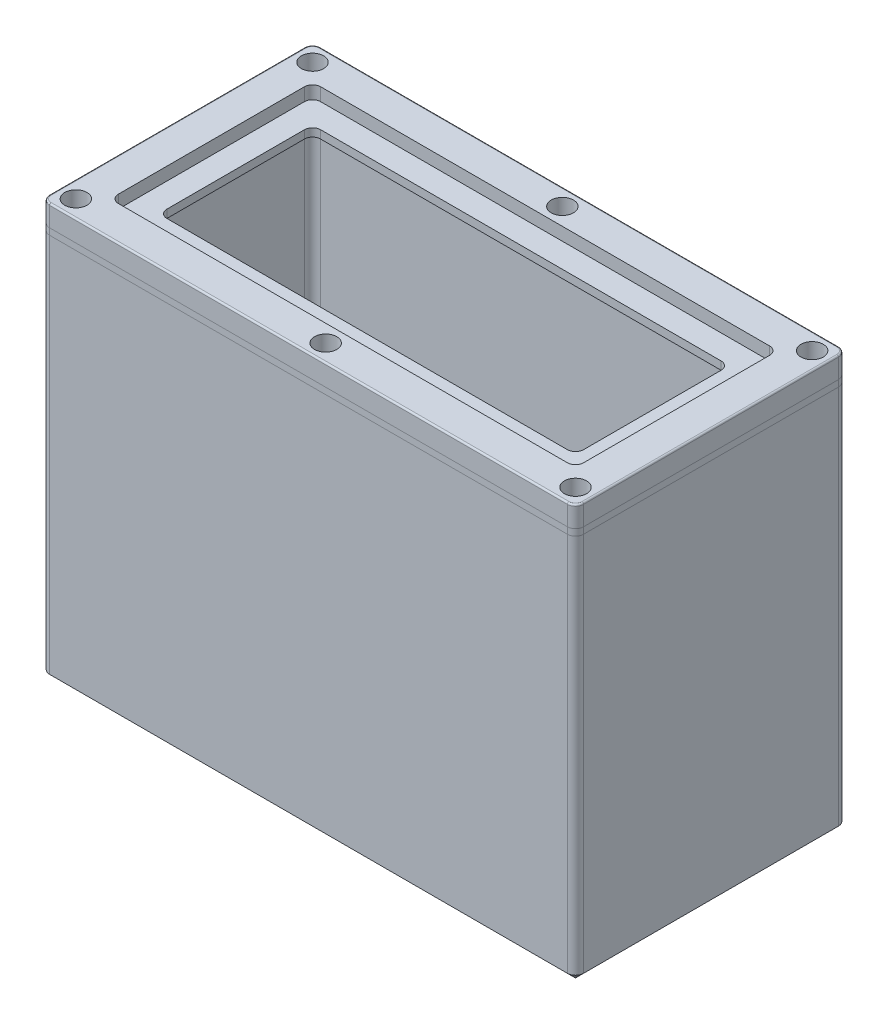
from build123d import *

# Parameters (mm, degrees)
BOX_OUTLINE_W            = 132
BOX_OUTLINE_H            = 67
BOSS_EXTRUDE2_DEPTH      = 4
BOX_OUTLINE_4_W          = 132
BOX_OUTLINE_4_H          = 67
BOX_OUTLINE_4_W_2        = 115
BOX_OUTLINE_4_H_2        = 50
BOSS_EXTRUDE3_DEPTH      = 92
MOTOR_OUTLINE_R          = 4.5
BOSS_EXTRUDE4_DEPTH      = 5
CUT_EXTRUDE1_DEPTH       = 119.077305186
CUT_EXTRUDE1_DEPTH_BACK  = 119.077305186
MOTOR_OUTLINE_3_R        = 4
M4_MOTOR_MOUNTS_D        = 4.5
SKETCH11_R               = 4.5
CABLE_GLAND_HOLE_DEPTH   = 8.5
M5_CLEARANCE_HOLE1_D     = 5.5
M5_CLEARANCE_HOLE1_DEPTH = 4
M5_CLEARANCE_HOLE1_TIP   = 1.652366702
SKETCH8_W                = 132
SKETCH8_H                = 67
SKETCH8_R                = 2.75
SKETCH8_W_2              = 115
SKETCH8_H_2              = 50
GLAND_DEPTH              = 1.6
SKETCH1_W                = 132
SKETCH1_H                = 67
SKETCH1_R                = 2.75
SKETCH1_W_2              = 115
SKETCH1_H_2              = 50
LID_DEPTH                = 5.2
SKETCH1_4_W              = 115
SKETCH1_4_H              = 50
SKETCH1_4_W_2            = 103
SKETCH1_4_H_2            = 38
LID_LIP_DEPTH            = 2
FILLET2_R                = 2
FILLET3_R                = 2
FILLET5_R                = 2
CHAMFER1_SIZE            = 2
FILLET4_R                = 2
FILLET6_R                = 0.4


with BuildPart() as part:
    # box_outline → Boss-Extrude2 (new body)
    with BuildSketch(Plane(origin=(0, 0, 0), x_dir=(1, 0, 0), z_dir=(0, 1, 0))):
        Rectangle(BOX_OUTLINE_W, BOX_OUTLINE_H)
    extrude(amount=-BOSS_EXTRUDE2_DEPTH)

    # box_outline<4> → Boss-Extrude3 (add)
    with BuildSketch(Plane(origin=(0, 0, 0), x_dir=(1, 0, 0), z_dir=(0, 1, 0))):
        Rectangle(BOX_OUTLINE_4_W, BOX_OUTLINE_4_H)
        Rectangle(BOX_OUTLINE_4_W_2, BOX_OUTLINE_4_H_2, mode=Mode.SUBTRACT)
    extrude(amount=BOSS_EXTRUDE3_DEPTH)

    # motor_outline → Boss-Extrude4 (add)
    with BuildSketch(Plane(origin=(0, 0, 0), x_dir=(1, 0, 0), z_dir=(0, 1, 0))):
        with Locations(Location((45.9, -14, 0), (0, 0, 90))):
            Circle(MOTOR_OUTLINE_R)
        with Locations(Location((5.9, -14, 0), (0, 0, 90))):
            Circle(MOTOR_OUTLINE_R)
        with Locations(Location((5.9, 14, 0), (0, 0, 90))):
            Circle(MOTOR_OUTLINE_R)
        with Locations(Location((45.9, 14, 0), (0, 0, 90))):
            Circle(MOTOR_OUTLINE_R)
    extrude(amount=BOSS_EXTRUDE4_DEPTH)

    # motor_outline<3> → Cut-Extrude1 (cut, two sides: drawn at the far end of the back side and taken through both)
    with BuildSketch(Plane(origin=(0, 0, 0), x_dir=(1, 0, 0), z_dir=(0, 1, 0)).offset(-CUT_EXTRUDE1_DEPTH_BACK)):
        with Locations(Location((34.5, 0, 0), (0, 0, 270))):
            Circle(MOTOR_OUTLINE_3_R)
    extrude(amount=CUT_EXTRUDE1_DEPTH + CUT_EXTRUDE1_DEPTH_BACK, mode=Mode.SUBTRACT)

    # M4 motor mounts (through all)
    with Locations(Plane(origin=(0, 5, 0), x_dir=(1, 0, 0), z_dir=(0, 1, 0))):
        with Locations((45.9, -14), (5.9, -14), (5.9, 14), (45.9, 14)):
            Hole(M4_MOTOR_MOUNTS_D / 2)

    # Sketch11 → cable gland hole (cut)
    with BuildSketch(Plane.ZY.offset(66)):
        with Locations((0, 62)):
            Circle(SKETCH11_R)
    extrude(amount=-CABLE_GLAND_HOLE_DEPTH, mode=Mode.SUBTRACT)

    # M5 Clearance Hole1
    with Locations(Plane(origin=(61.75, 92, 29.25), x_dir=(0, 0, 1), z_dir=(0, 1, 0))):
        with Locations((0, 0), (0, -61.75), (0, -123.5), (-58.5, -123.5), (-58.5, -61.75), (-58.5, 0)):
            Hole(M5_CLEARANCE_HOLE1_D / 2, depth=M5_CLEARANCE_HOLE1_DEPTH)
            with Locations((0, 0, -(M5_CLEARANCE_HOLE1_DEPTH + M5_CLEARANCE_HOLE1_TIP / 2))):  # 118° drill point
                Cone(0, M5_CLEARANCE_HOLE1_D / 2, M5_CLEARANCE_HOLE1_TIP, mode=Mode.SUBTRACT)

    # Fillet3
    fillet3_edges = [part.edges().sort_by_distance(p)[0] for p in [
        (57.5, 46, -25),
        (57.5, 46, 25),
        (-57.5, 46, 25),
        (-57.5, 46, -25),
        (-66, 44, 33.5),
        (66, 44, 33.5),
        (66, 44, -33.5),
        (-66, 44, -33.5),
    ]]
    fillet(fillet3_edges, radius=FILLET3_R)

    # Chamfer1
    chamfer1_edges = [part.edges().sort_by_distance(p)[0] for p in [
        (0, -4, 33.5),
        (66, -4, 0),
        (-66, -4, 0),
        (0, -4, -33.5),
        (65.414213562, -4, -32.914213562),
        (-65.414213562, -4, -32.914213562),
        (-65.414213562, -4, 32.914213562),
        (65.414213562, -4, 32.914213562),
    ]]
    chamfer(chamfer1_edges, length=CHAMFER1_SIZE)

    # Fillet4
    fillet4_edges = [part.edges().sort_by_distance(p)[0] for p in [
        (0, 0, 25),
        (57.5, 0, 0),
        (0, 0, -25),
        (-57.5, 0, 0),
        (-56.914213562, 0, -24.414213562),
        (56.914213562, 0, -24.414213562),
        (-56.914213562, 0, 24.414213562),
        (56.914213562, 0, 24.414213562),
    ]]
    fillet(fillet4_edges, radius=FILLET4_R)


with BuildPart() as body_2:
    # Sketch8 → gland (new body)
    with BuildSketch(Plane(origin=(0, 92, 0), x_dir=(1, 0, 0), z_dir=(0, 1, 0))):
        Rectangle(SKETCH8_W, SKETCH8_H)
        with Locations(Location((0, -29.25, 0), (0, 0, 270))):
            Circle(SKETCH8_R, mode=Mode.SUBTRACT)
        with Locations(Location((-61.75, 29.25, 0), (0, 0, 270))):
            Circle(SKETCH8_R, mode=Mode.SUBTRACT)
        with Locations(Location((61.75, 29.25, 0), (0, 0, 270))):
            Circle(SKETCH8_R, mode=Mode.SUBTRACT)
        with Locations(Location((0, 29.25, 0), (0, 0, 270))):
            Circle(SKETCH8_R, mode=Mode.SUBTRACT)
        with Locations(Location((-61.75, -29.25, 0), (0, 0, 270))):
            Circle(SKETCH8_R, mode=Mode.SUBTRACT)
        with Locations(Location((61.75, -29.25, 0), (0, 0, 270))):
            Circle(SKETCH8_R, mode=Mode.SUBTRACT)
        Rectangle(SKETCH8_W_2, SKETCH8_H_2, mode=Mode.SUBTRACT)
    extrude(amount=GLAND_DEPTH)

    # Fillet5
    fillet5_edges = [body_2.edges().sort_by_distance(p)[0] for p in [
        (66, 92.8, -33.5),
        (66, 92.8, 33.5),
        (-66, 92.8, 33.5),
        (-66, 92.8, -33.5),
        (-57.5, 92.8, -25),
        (-57.5, 92.8, 25),
        (57.5, 92.8, 25),
        (57.5, 92.8, -25),
    ]]
    fillet(fillet5_edges, radius=FILLET5_R)


with BuildPart() as body_3:
    # Sketch1 → lid (new body)
    with BuildSketch(Plane(origin=(0, 93.6, 0), x_dir=(1, 0, 0), z_dir=(0, 1, 0))):
        Rectangle(SKETCH1_W, SKETCH1_H)
        with Locations(Location((0, -29.25, 0), (0, 0, 270))):
            Circle(SKETCH1_R, mode=Mode.SUBTRACT)
        with Locations(Location((61.75, -29.25, 0), (0, 0, 270))):
            Circle(SKETCH1_R, mode=Mode.SUBTRACT)
        with Locations(Location((61.75, 29.25, 0), (0, 0, 270))):
            Circle(SKETCH1_R, mode=Mode.SUBTRACT)
        with Locations(Location((0, 29.25, 0), (0, 0, 270))):
            Circle(SKETCH1_R, mode=Mode.SUBTRACT)
        with Locations(Location((-61.75, 29.25, 0), (0, 0, 270))):
            Circle(SKETCH1_R, mode=Mode.SUBTRACT)
        with Locations(Location((-61.75, -29.25, 0), (0, 0, 270))):
            Circle(SKETCH1_R, mode=Mode.SUBTRACT)
        Rectangle(SKETCH1_W_2, SKETCH1_H_2, mode=Mode.SUBTRACT)
    extrude(amount=LID_DEPTH)

    # Sketch1<4> → lid lip (add)
    with BuildSketch(Plane(origin=(0, 93.6, 0), x_dir=(1, 0, 0), z_dir=(0, 1, 0))):
        Rectangle(SKETCH1_4_W, SKETCH1_4_H)
        Rectangle(SKETCH1_4_W_2, SKETCH1_4_H_2, mode=Mode.SUBTRACT)
    extrude(amount=LID_LIP_DEPTH)

    # Fillet2
    fillet2_edges = [body_3.edges().sort_by_distance(p)[0] for p in [
        (57.5, 97.2, 25),
        (57.5, 97.2, -25),
        (-57.5, 97.2, -25),
        (-57.5, 97.2, 25),
        (66, 96.2, 33.5),
        (-66, 96.2, 33.5),
        (-66, 96.2, -33.5),
        (66, 96.2, -33.5),
        (-51.5, 94.6, 19),
        (-51.5, 94.6, -19),
        (51.5, 94.6, -19),
        (51.5, 94.6, 19),
    ]]
    fillet(fillet2_edges, radius=FILLET2_R)

    # Fillet6
    fillet6_edges = [body_3.edges().sort_by_distance(p)[0] for p in [
        (0, 98.8, -33.5),
        (66, 98.8, 0),
        (-66, 98.8, 0),
        (0, 98.8, 33.5),
        (-65.414213562, 98.8, 32.914213562),
        (-65.414213562, 98.8, -32.914213562),
        (65.414213562, 98.8, 32.914213562),
        (65.414213562, 98.8, -32.914213562),
    ]]
    fillet(fillet6_edges, radius=FILLET6_R)


solid = Compound([part.part, body_2.part, body_3.part])
